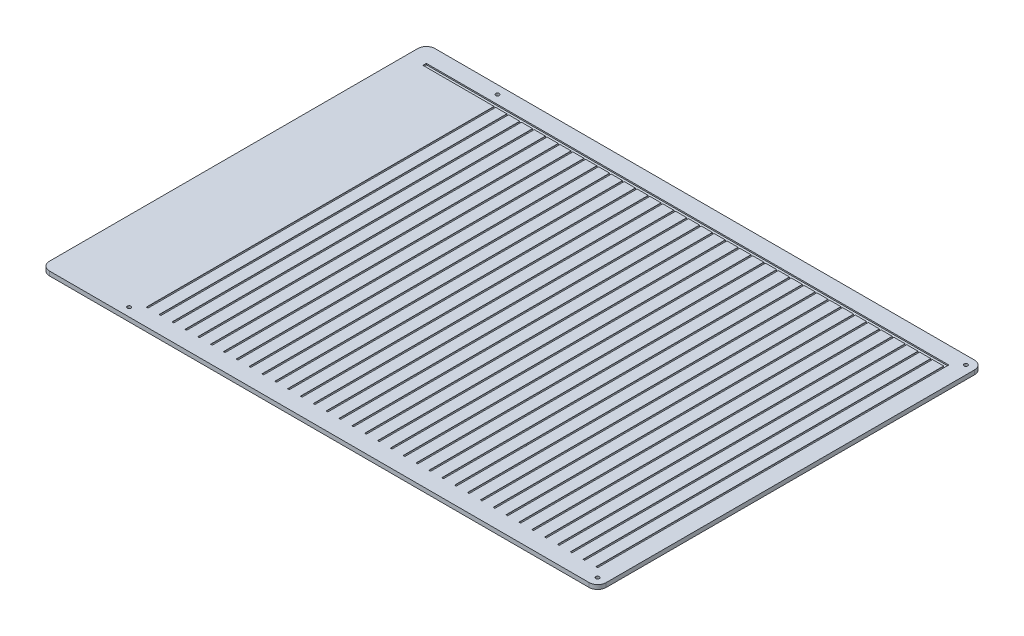
from build123d import *

# Parameters (mm, degrees)
BOSS_EXTRUDE1_DEPTH         = 5
CUT_EXTRUDE2_START          = -20
CUT_EXTRUDE2_DEPTH          = 410
SKETCH6_W                   = 4
SKETCH6_H                   = 1
SKETCH6_H_2                 = 0.5
CUT_EXTRUDE3_DEPTH          = 610
TAP_DRILL_FOR_M5X0_8_TAP2_D = 4.2
FILLET2_R                   = 10


with BuildPart() as part:
    # Sketch1 → Boss-Extrude1 (new body)
    with BuildSketch(Plane(origin=(0, 0, 0), x_dir=(1, 0, 0), z_dir=(0, 1, 0))):
        Polygon((-300, -225), (300, -225), (300, 225), (-300, 225), (-350, 225), (-350, -225), align=None)
    extrude(amount=BOSS_EXTRUDE1_DEPTH)

    # Sketch4 → Cut-Extrude2 (cut)
    with BuildSketch(Plane.XY.offset(225).offset(CUT_EXTRUDE2_START)):
        with BuildLine():
            Line((278, 4.5), (278, 5))
            Line((278, 5), (280, 5))
            Line((280, 5), (280, 4.5))
            ThreePointArc((280, 4.5), (279, 3.5), (278, 4.5))
        make_face()
        with BuildLine():
            Line((263, 4.5), (263, 5))
            Line((263, 5), (265, 5))
            Line((265, 5), (265, 4.5))
            ThreePointArc((265, 4.5), (264, 3.5), (263, 4.5))
        make_face()
        with BuildLine():
            Line((248, 4.5), (248, 5))
            Line((248, 5), (250, 5))
            Line((250, 5), (250, 4.5))
            ThreePointArc((250, 4.5), (249, 3.5), (248, 4.5))
        make_face()
        with BuildLine():
            Line((233, 4.5), (233, 5))
            Line((233, 5), (235, 5))
            Line((235, 5), (235, 4.5))
            ThreePointArc((235, 4.5), (234, 3.5), (233, 4.5))
        make_face()
        with BuildLine():
            Line((218, 4.5), (218, 5))
            Line((218, 5), (220, 5))
            Line((220, 5), (220, 4.5))
            ThreePointArc((220, 4.5), (219, 3.5), (218, 4.5))
        make_face()
        with BuildLine():
            Line((203, 4.5), (203, 5))
            Line((203, 5), (205, 5))
            Line((205, 5), (205, 4.5))
            ThreePointArc((205, 4.5), (204, 3.5), (203, 4.5))
        make_face()
        with BuildLine():
            Line((188, 4.5), (188, 5))
            Line((188, 5), (190, 5))
            Line((190, 5), (190, 4.5))
            ThreePointArc((190, 4.5), (189, 3.5), (188, 4.5))
        make_face()
        with BuildLine():
            Line((173, 4.5), (173, 5))
            Line((173, 5), (175, 5))
            Line((175, 5), (175, 4.5))
            ThreePointArc((175, 4.5), (174, 3.5), (173, 4.5))
        make_face()
        with BuildLine():
            Line((158, 4.5), (158, 5))
            Line((158, 5), (160, 5))
            Line((160, 5), (160, 4.5))
            ThreePointArc((160, 4.5), (159, 3.5), (158, 4.5))
        make_face()
        with BuildLine():
            Line((143, 4.5), (143, 5))
            Line((143, 5), (145, 5))
            Line((145, 5), (145, 4.5))
            ThreePointArc((145, 4.5), (144, 3.5), (143, 4.5))
        make_face()
        with BuildLine():
            Line((128, 4.5), (128, 5))
            Line((128, 5), (130, 5))
            Line((130, 5), (130, 4.5))
            ThreePointArc((130, 4.5), (129, 3.5), (128, 4.5))
        make_face()
        with BuildLine():
            Line((113, 4.5), (113, 5))
            Line((113, 5), (115, 5))
            Line((115, 5), (115, 4.5))
            ThreePointArc((115, 4.5), (114, 3.5), (113, 4.5))
        make_face()
        with BuildLine():
            Line((98, 4.5), (98, 5))
            Line((98, 5), (100, 5))
            Line((100, 5), (100, 4.5))
            ThreePointArc((100, 4.5), (99, 3.5), (98, 4.5))
        make_face()
        with BuildLine():
            Line((83, 4.5), (83, 5))
            Line((83, 5), (85, 5))
            Line((85, 5), (85, 4.5))
            ThreePointArc((85, 4.5), (84, 3.5), (83, 4.5))
        make_face()
        with BuildLine():
            Line((68, 4.5), (68, 5))
            Line((68, 5), (70, 5))
            Line((70, 5), (70, 4.5))
            ThreePointArc((70, 4.5), (69, 3.5), (68, 4.5))
        make_face()
        with BuildLine():
            Line((53, 4.5), (53, 5))
            Line((53, 5), (55, 5))
            Line((55, 5), (55, 4.5))
            ThreePointArc((55, 4.5), (54, 3.5), (53, 4.5))
        make_face()
        with BuildLine():
            Line((38, 4.5), (38, 5))
            Line((38, 5), (40, 5))
            Line((40, 5), (40, 4.5))
            ThreePointArc((40, 4.5), (39, 3.5), (38, 4.5))
        make_face()
        with BuildLine():
            Line((23, 4.5), (23, 5))
            Line((23, 5), (25, 5))
            Line((25, 5), (25, 4.5))
            ThreePointArc((25, 4.5), (24, 3.5), (23, 4.5))
        make_face()
        with BuildLine():
            Line((8, 4.5), (8, 5))
            Line((8, 5), (10, 5))
            Line((10, 5), (10, 4.5))
            ThreePointArc((10, 4.5), (9, 3.5), (8, 4.5))
        make_face()
        with BuildLine():
            Line((-7, 4.5), (-7, 5))
            Line((-7, 5), (-5, 5))
            Line((-5, 5), (-5, 4.5))
            ThreePointArc((-5, 4.5), (-6, 3.5), (-7, 4.5))
        make_face()
        with BuildLine():
            Line((-22, 4.5), (-22, 5))
            Line((-22, 5), (-20, 5))
            Line((-20, 5), (-20, 4.5))
            ThreePointArc((-20, 4.5), (-21, 3.5), (-22, 4.5))
        make_face()
        with BuildLine():
            Line((-37, 4.5), (-37, 5))
            Line((-37, 5), (-35, 5))
            Line((-35, 5), (-35, 4.5))
            ThreePointArc((-35, 4.5), (-36, 3.5), (-37, 4.5))
        make_face()
        with BuildLine():
            Line((-52, 4.5), (-52, 5))
            Line((-52, 5), (-50, 5))
            Line((-50, 5), (-50, 4.5))
            ThreePointArc((-50, 4.5), (-51, 3.5), (-52, 4.5))
        make_face()
        with BuildLine():
            Line((-67, 4.5), (-67, 5))
            Line((-67, 5), (-65, 5))
            Line((-65, 5), (-65, 4.5))
            ThreePointArc((-65, 4.5), (-66, 3.5), (-67, 4.5))
        make_face()
        with BuildLine():
            Line((-82, 4.5), (-82, 5))
            Line((-82, 5), (-80, 5))
            Line((-80, 5), (-80, 4.5))
            ThreePointArc((-80, 4.5), (-81, 3.5), (-82, 4.5))
        make_face()
        with BuildLine():
            Line((-97, 4.5), (-97, 5))
            Line((-97, 5), (-95, 5))
            Line((-95, 5), (-95, 4.5))
            ThreePointArc((-95, 4.5), (-96, 3.5), (-97, 4.5))
        make_face()
        with BuildLine():
            Line((-112, 4.5), (-112, 5))
            Line((-112, 5), (-110, 5))
            Line((-110, 5), (-110, 4.5))
            ThreePointArc((-110, 4.5), (-111, 3.5), (-112, 4.5))
        make_face()
        with BuildLine():
            Line((-127, 4.5), (-127, 5))
            Line((-127, 5), (-125, 5))
            Line((-125, 5), (-125, 4.5))
            ThreePointArc((-125, 4.5), (-126, 3.5), (-127, 4.5))
        make_face()
        with BuildLine():
            Line((-142, 4.5), (-142, 5))
            Line((-142, 5), (-140, 5))
            Line((-140, 5), (-140, 4.5))
            ThreePointArc((-140, 4.5), (-141, 3.5), (-142, 4.5))
        make_face()
        with BuildLine():
            Line((-157, 4.5), (-157, 5))
            Line((-157, 5), (-155, 5))
            Line((-155, 5), (-155, 4.5))
            ThreePointArc((-155, 4.5), (-156, 3.5), (-157, 4.5))
        make_face()
        with BuildLine():
            Line((-172, 4.5), (-172, 5))
            Line((-172, 5), (-170, 5))
            Line((-170, 5), (-170, 4.5))
            ThreePointArc((-170, 4.5), (-171, 3.5), (-172, 4.5))
        make_face()
        with BuildLine():
            Line((-187, 4.5), (-187, 5))
            Line((-187, 5), (-185, 5))
            Line((-185, 5), (-185, 4.5))
            ThreePointArc((-185, 4.5), (-186, 3.5), (-187, 4.5))
        make_face()
        with BuildLine():
            Line((-202, 4.5), (-202, 5))
            Line((-202, 5), (-200, 5))
            Line((-200, 5), (-200, 4.5))
            ThreePointArc((-200, 4.5), (-201, 3.5), (-202, 4.5))
        make_face()
        with BuildLine():
            Line((-217, 4.5), (-217, 5))
            Line((-217, 5), (-215, 5))
            Line((-215, 5), (-215, 4.5))
            ThreePointArc((-215, 4.5), (-216, 3.5), (-217, 4.5))
        make_face()
        with BuildLine():
            Line((-232, 4.5), (-232, 5))
            Line((-232, 5), (-230, 5))
            Line((-230, 5), (-230, 4.5))
            ThreePointArc((-230, 4.5), (-231, 3.5), (-232, 4.5))
        make_face()
        with BuildLine():
            Line((-247, 4.5), (-247, 5))
            Line((-247, 5), (-245, 5))
            Line((-245, 5), (-245, 4.5))
            ThreePointArc((-245, 4.5), (-246, 3.5), (-247, 4.5))
        make_face()
    extrude(amount=-CUT_EXTRUDE2_DEPTH, mode=Mode.SUBTRACT)

    # Sketch6 → Cut-Extrude3 (cut)
    with BuildSketch(Plane.ZY.offset(-280)):
        with Locations((-203, 4)):
            Rectangle(SKETCH6_W, SKETCH6_H)
        with Locations((-203, 4.75)):
            Rectangle(SKETCH6_W, SKETCH6_H_2)
    extrude(amount=CUT_EXTRUDE3_DEPTH, mode=Mode.SUBTRACT)

    # Tap Drill for M5x0.8 Tap2 (through all)
    with Locations(Plane(origin=(290, 5, -215), x_dir=(0, 0, 1), z_dir=(0, 1, 0))):
        with Locations((0, 0), (430, 0), (430, -547), (0, -547)):
            Hole(TAP_DRILL_FOR_M5X0_8_TAP2_D / 2)

    # Fillet2
    fillet2_edges = [part.edges().sort_by_distance(p)[0] for p in [
        (300, 2.5, 225),
        (-350, 2.5, 225),
        (-350, 2.5, -225),
        (300, 2.5, -225),
    ]]
    fillet(fillet2_edges, radius=FILLET2_R)


solid = part.part
